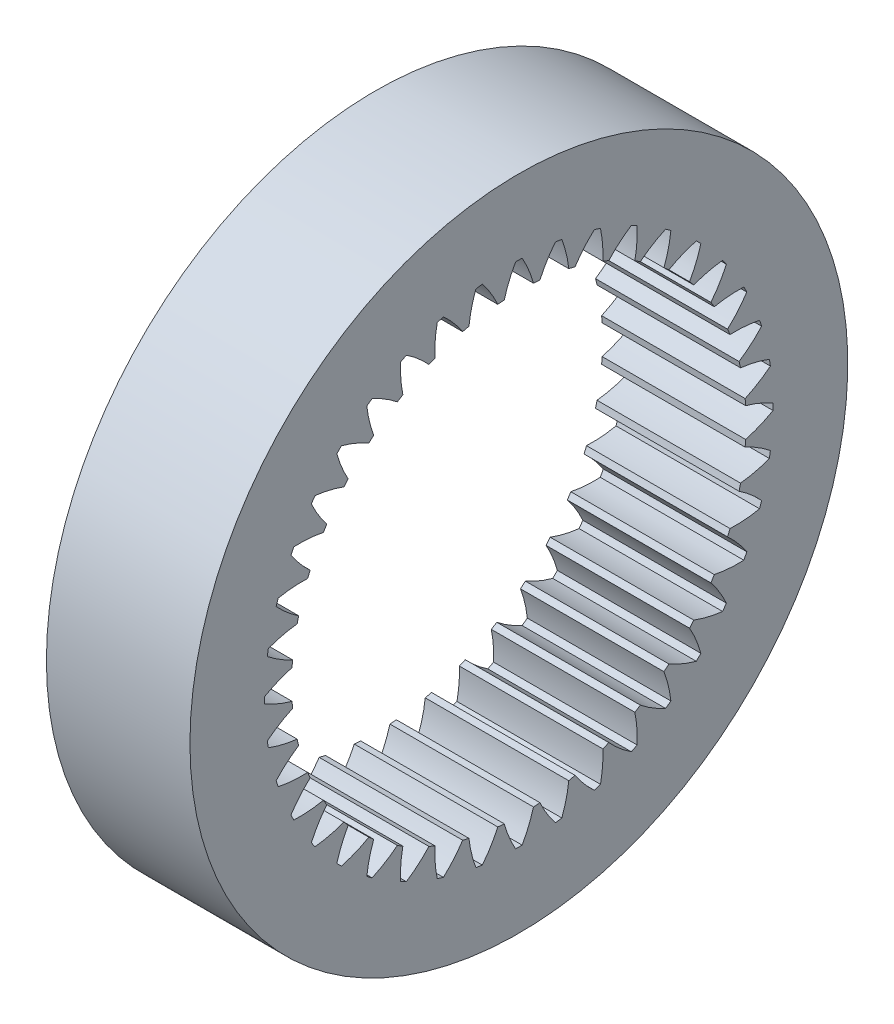
from build123d import *

# Parameters (mm, degrees)
BASPROSKE_W     = 12
BASPROSKE_H     = 8.5
TOOTHCUT_DEPTH  = 41.70012285
TEETHCUTS_COUNT = 40
TEETHCUTS_ANGLE = 351


with BuildPart() as part:
    # BasProSke → Base-Revolve (revolve)
    with BuildSketch(Plane(origin=(0, 0, 0), x_dir=(1, 0, 0), z_dir=(0, 1, 0)), mode=Mode.PRIVATE) as base_revolve_sk:
        with Locations((6, 23.25)):
            Rectangle(BASPROSKE_W, BASPROSKE_H)
    revolve(base_revolve_sk.sketch.rotate(Axis((-10, 0, 0), (1, 0, 0)), 180), axis=Axis((-10, 0, 0), (1, 0, 0)))

    # TooCutSke → ToothCut (cut, through all)
    with BuildSketch(Plane(origin=(0, 0, 0), x_dir=(0, 0, -1), z_dir=(1, 0, 0))):
        with BuildLine():
            ThreePointArc((1.228324582, 18.934800339), (0.823024268, 20.12207302), (0.272257981, 21.249255907))
            ThreePointArc((0.272257981, 21.249255907), (0, 21.251), (-0.272257981, 21.249255907))
            ThreePointArc((-0.272257981, 21.249255907), (-0.823024268, 20.12207302), (-1.228324582, 18.934800339))
            ThreePointArc((-1.228324582, 18.934800339), (0, 18.9746), (1.228324582, 18.934800339))
        make_face()
    toothcut = extrude(amount=TOOTHCUT_DEPTH, mode=Mode.SUBTRACT)

    # TeethCuts: ToothCut ×40 about axis
    teethcuts_axis = Axis((-10, 0, 0), (1, 0, 0))
    for i in range(1, TEETHCUTS_COUNT):
        add(toothcut.rotate(teethcuts_axis, i * TEETHCUTS_ANGLE / (TEETHCUTS_COUNT - 1)), mode=Mode.SUBTRACT)


solid = part.part
